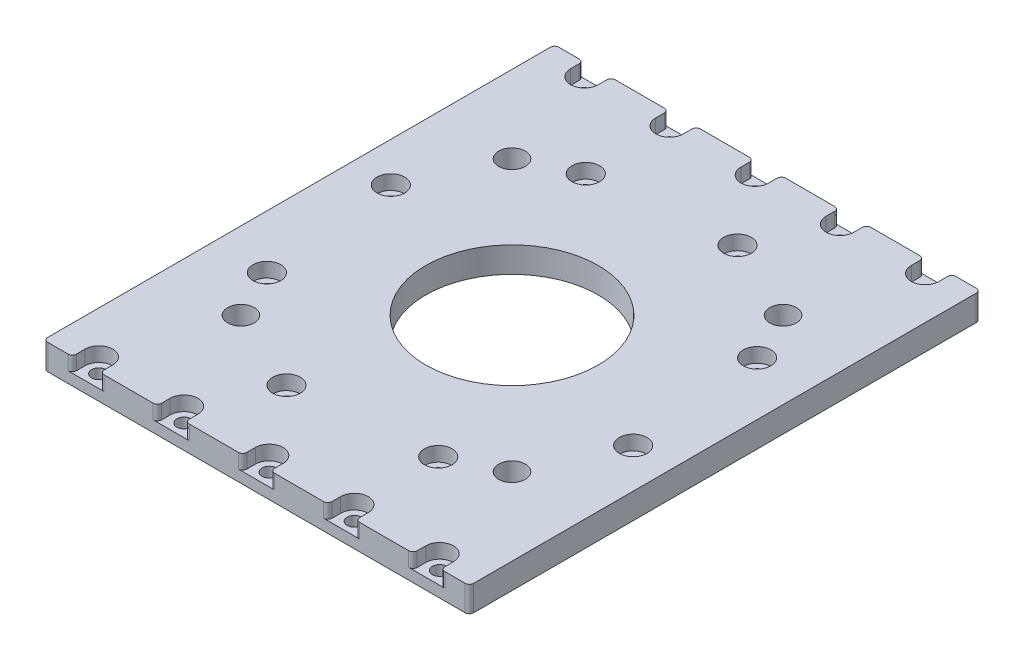
from build123d import *

# Parameters (mm, degrees)
SKETCH1_R                                           = 50
SKETCH1_R_2                                         = 20.25
BOSS_EXTRUDE1_DEPTH                                 = 6
CBORE_FOR_M3_HEX_SOCKET_HEAD_CAP_SCREW2_D           = 3.4
CBORE_FOR_M3_HEX_SOCKET_HEAD_CAP_SCREW2_CBORE_D     = 6.5
CBORE_FOR_M3_HEX_SOCKET_HEAD_CAP_SCREW2_CBORE_DEPTH = 3.4
BOSS_EXTRUDE2_START                                 = -6
BOSS_EXTRUDE2_DEPTH                                 = 6
BOSS_EXTRUDE3_START                                 = -6
BOSS_EXTRUDE3_DEPTH                                 = 6
CBORE_FOR_M3_HEX_SOCKET_HEAD_CAP_SCREW1_D           = 3.4
CBORE_FOR_M3_HEX_SOCKET_HEAD_CAP_SCREW1_CBORE_D     = 6.5
CBORE_FOR_M3_HEX_SOCKET_HEAD_CAP_SCREW1_CBORE_DEPTH = 3.4
CUT_EXTRUDE1_DEPTH                                  = 3.4
FILLET1_R                                           = 1
TAP_DRILL_FOR_M6_HELICOIL1_D                        = 6.25


with BuildPart() as part:
    # Sketch1 → Boss-Extrude1 (new body)
    with BuildSketch(Plane(origin=(0, 0, 0), x_dir=(1, 0, 0), z_dir=(0, 1, 0))):
        with Locations(Location((0, 0, 0), (0, 0, 270))):
            Circle(SKETCH1_R)
        with Locations(Location((0, 0, 0), (0, 0, 270))):
            Circle(SKETCH1_R_2, mode=Mode.SUBTRACT)
    extrude(amount=BOSS_EXTRUDE1_DEPTH)

    # CBORE for M3 Hex Socket Head Cap Screw2 (through all)
    with Locations(Plane(origin=(0, 6, 0), x_dir=(1, 0, 0), z_dir=(0, 1, 0))):
        with Locations((-40.696782834, 12.248341396), (-20.116085855, 37.437856374), (12.248341396, 40.696782834), (37.437856374, 20.116085855), (40.696782834, -12.248341396), (20.116085855, -37.437856374), (-12.248341396, -40.696782834), (-37.437856374, -20.116085855)):
            CounterBoreHole(CBORE_FOR_M3_HEX_SOCKET_HEAD_CAP_SCREW2_D / 2, CBORE_FOR_M3_HEX_SOCKET_HEAD_CAP_SCREW2_CBORE_D / 2, CBORE_FOR_M3_HEX_SOCKET_HEAD_CAP_SCREW2_CBORE_DEPTH)

    # Sketch6 → Boss-Extrude2 (add)
    with BuildSketch(Plane(origin=(0, 6, 0), x_dir=(1, 0, 0), z_dir=(0, 1, 0)).offset(BOSS_EXTRUDE2_START)):
        with BuildLine():
            Line((-50, 0), (-50, -60))
            Line((-50, -60), (50, -60))
            Line((50, -60), (50, 0))
            ThreePointArc((50, 0), (0, -50), (-50, 0))
        make_face()
    extrude(amount=BOSS_EXTRUDE2_DEPTH)

    # Sketch10 → Boss-Extrude3 (add)
    with BuildSketch(Plane(origin=(0, 6, 0), x_dir=(1, 0, 0), z_dir=(0, 1, 0)).offset(BOSS_EXTRUDE3_START)):
        with BuildLine():
            Line((-50, 0), (-50, 60))
            Line((-50, 60), (50, 60))
            Line((50, 60), (50, 0))
            ThreePointArc((50, 0), (0, 50), (-50, 0))
        make_face()
    extrude(amount=BOSS_EXTRUDE3_DEPTH)

    # CBORE for M3 Hex Socket Head Cap Screw1 (through all)
    with Locations(Plane(origin=(0, 6, 0), x_dir=(1, 0, 0), z_dir=(0, 1, 0))):
        with Locations((-40, 57), (-20, 57), (0, 57), (20, 57), (40, 57), (40, -57), (20, -57), (0, -57), (-20, -57), (-40, -57)):
            CounterBoreHole(CBORE_FOR_M3_HEX_SOCKET_HEAD_CAP_SCREW1_D / 2, CBORE_FOR_M3_HEX_SOCKET_HEAD_CAP_SCREW1_CBORE_D / 2, CBORE_FOR_M3_HEX_SOCKET_HEAD_CAP_SCREW1_CBORE_DEPTH)

    # Sketch13 → Cut-Extrude1 (cut)
    with BuildSketch(Plane(origin=(0, 6, 0), x_dir=(1, 0, 0), z_dir=(0, 1, 0))):
        with BuildLine():
            Line((-43.25, 57), (-43.25, 60))
            Line((-43.25, 60), (-36.75, 60))
            Line((-36.75, 60), (-36.75, 57))
            ThreePointArc((-36.75, 57), (-40, 53.75), (-43.25, 57))
        make_face()
        with BuildLine():
            Line((-23.25, 57), (-23.25, 60))
            Line((-23.25, 60), (-16.75, 60))
            Line((-16.75, 60), (-16.75, 57))
            ThreePointArc((-16.75, 57), (-20, 53.75), (-23.25, 57))
        make_face()
        with BuildLine():
            Line((-3.25, 57), (-3.25, 60))
            Line((-3.25, 60), (3.25, 60))
            Line((3.25, 60), (3.25, 57))
            ThreePointArc((3.25, 57), (0, 53.75), (-3.25, 57))
        make_face()
        with BuildLine():
            Line((16.75, 57), (16.75, 60))
            Line((16.75, 60), (23.25, 60))
            Line((23.25, 60), (23.25, 57))
            ThreePointArc((23.25, 57), (20, 53.75), (16.75, 57))
        make_face()
        with BuildLine():
            Line((36.75, 57), (36.75, 60))
            Line((36.75, 60), (43.25, 60))
            Line((43.25, 60), (43.25, 57))
            ThreePointArc((43.25, 57), (40, 53.75), (36.75, 57))
        make_face()
        with BuildLine():
            Line((43.25, -60), (43.25, -57))
            ThreePointArc((43.25, -57), (40, -53.75), (36.75, -57))
            Line((36.75, -57), (36.75, -60))
            Line((36.75, -60), (43.25, -60))
        make_face()
        with BuildLine():
            Line((23.25, -60), (23.25, -57))
            ThreePointArc((23.25, -57), (20, -53.75), (16.75, -57))
            Line((16.75, -57), (16.75, -60))
            Line((16.75, -60), (23.25, -60))
        make_face()
        with BuildLine():
            Line((3.25, -60), (3.25, -57))
            ThreePointArc((3.25, -57), (0, -53.75), (-3.25, -57))
            Line((-3.25, -57), (-3.25, -60))
            Line((-3.25, -60), (3.25, -60))
        make_face()
        with BuildLine():
            Line((-16.75, -60), (-16.75, -57))
            ThreePointArc((-16.75, -57), (-20, -53.75), (-23.25, -57))
            Line((-23.25, -57), (-23.25, -60))
            Line((-23.25, -60), (-16.75, -60))
        make_face()
        with BuildLine():
            Line((-36.75, -60), (-36.75, -57))
            ThreePointArc((-36.75, -57), (-40, -53.75), (-43.25, -57))
            Line((-43.25, -57), (-43.25, -60))
            Line((-43.25, -60), (-36.75, -60))
        make_face()
    extrude(amount=-CUT_EXTRUDE1_DEPTH, mode=Mode.SUBTRACT)

    # Fillet1
    fillet1_edges = [part.edges().sort_by_distance(p)[0] for p in [
        (-36.75, 4.3, 60),
        (-43.25, 4.3, 60),
        (-16.75, 4.3, 60),
        (-23.25, 4.3, 60),
        (3.25, 4.3, 60),
        (-3.25, 4.3, 60),
        (23.25, 4.3, 60),
        (16.75, 4.3, 60),
        (43.25, 4.3, 60),
        (36.75, 4.3, 60),
        (36.75, 4.3, -60),
        (43.25, 4.3, -60),
        (16.75, 4.3, -60),
        (23.25, 4.3, -60),
        (-3.25, 4.3, -60),
        (3.25, 4.3, -60),
        (-23.25, 4.3, -60),
        (-16.75, 4.3, -60),
        (-43.25, 4.3, -60),
        (-36.75, 4.3, -60),
        (50, 3, 60),
        (-50, 3, 60),
        (-50, 3, -60),
        (50, 3, -60),
    ]]
    fillet(fillet1_edges, radius=FILLET1_R)

    # Tap Drill for M6 Helicoil1 (through all)
    with Locations(Plane(origin=(0, 6, 0), x_dir=(1, 0, 0), z_dir=(0, 1, 0))):
        with Locations((31.819805153, -31.819805153), (31.819805153, 31.819805153), (-31.819805153, -31.819805153), (-31.819805153, 31.819805153), (0, 0)):
            Hole(TAP_DRILL_FOR_M6_HELICOIL1_D / 2)


solid = part.part
